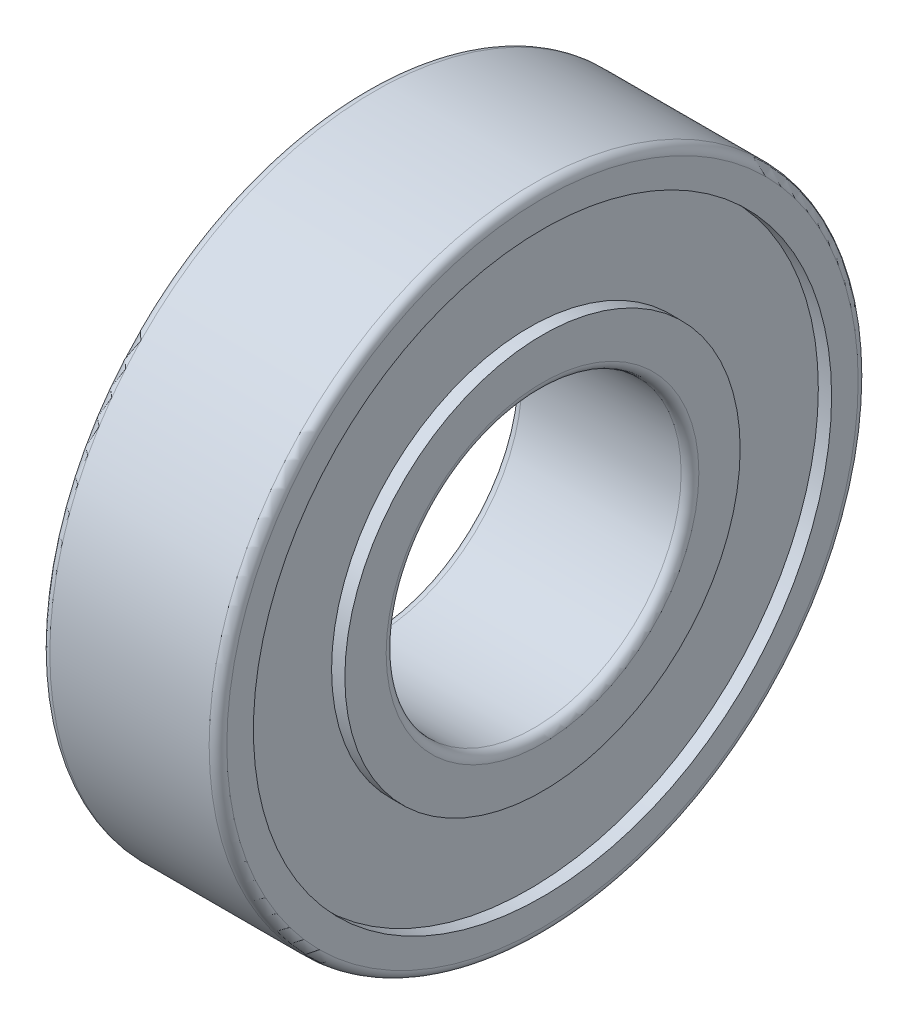
from build123d import *


with BuildPart() as part:
    # Sketch1 → Revolve1 (revolve)
    with BuildSketch(Plane.XY, mode=Mode.PRIVATE) as revolve1_sk:
        with BuildLine():
            Line((0.3, 5), (5.7, 5))
            ThreePointArc((5.7, 5), (5.912132034, 5.087867966), (6, 5.3))
            Line((6, 5.3), (6, 6.7))
            Line((6, 6.7), (5.55, 6.7))
            Line((5.55, 6.7), (5.55, 9.8))
            Line((5.55, 9.8), (6, 9.8))
            Line((6, 9.8), (6, 10.7))
            ThreePointArc((6, 10.7), (5.912132034, 10.912132034), (5.7, 11))
            Line((5.7, 11), (0.3, 11))
            ThreePointArc((0.3, 11), (0.087867966, 10.912132034), (0, 10.7))
            Line((0, 10.7), (0, 9.8))
            Line((0, 9.8), (0.45, 9.8))
            Line((0.45, 9.8), (0.45, 6.7))
            Line((0.45, 6.7), (0, 6.7))
            Line((0, 6.7), (0, 5.3))
            ThreePointArc((0, 5.3), (0.087867966, 5.087867966), (0.3, 5))
        make_face()
    revolve(revolve1_sk.sketch.rotate(Axis((-0.001253994, 0, 0), (1, 0, 0)), 270), axis=Axis((-0.001253994, 0, 0), (1, 0, 0)))


solid = part.part
